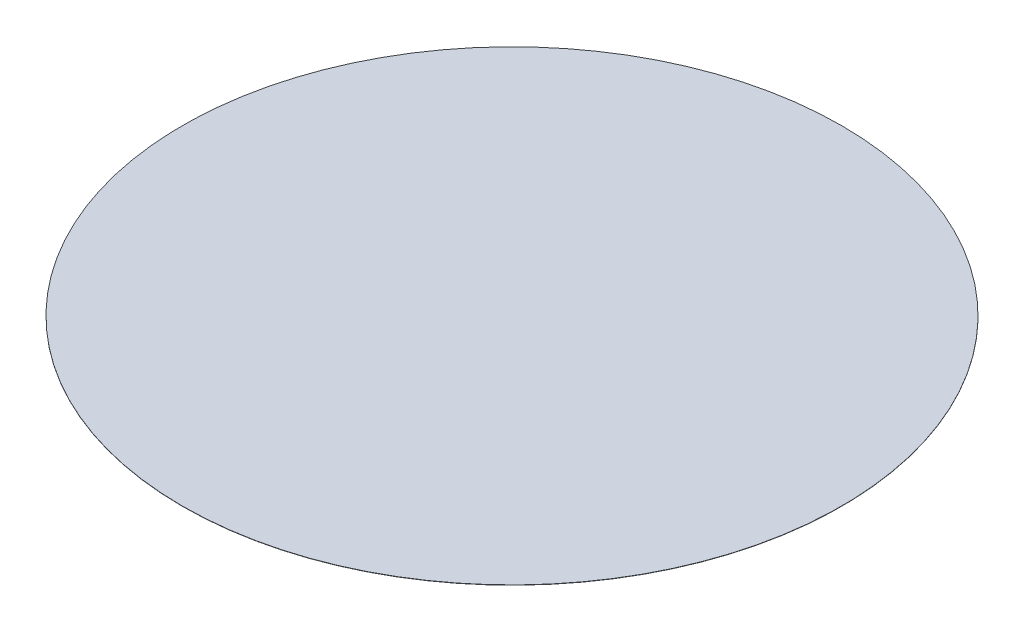
from build123d import *

# Parameters (mm, degrees)
SKETCH1_R           = 2500
BOSS_EXTRUDE1_DEPTH = 1


with BuildPart() as part:
    # Sketch1 → Boss-Extrude1 (new, symmetric)
    with BuildSketch(Plane(origin=(0, 0, 0), x_dir=(1, 0, 0), z_dir=(0, 1, 0))):
        with Locations(Location((0, 0, 0), (0, 0, 270))):
            Circle(SKETCH1_R)
    extrude(amount=BOSS_EXTRUDE1_DEPTH, both=True)


solid = part.part
